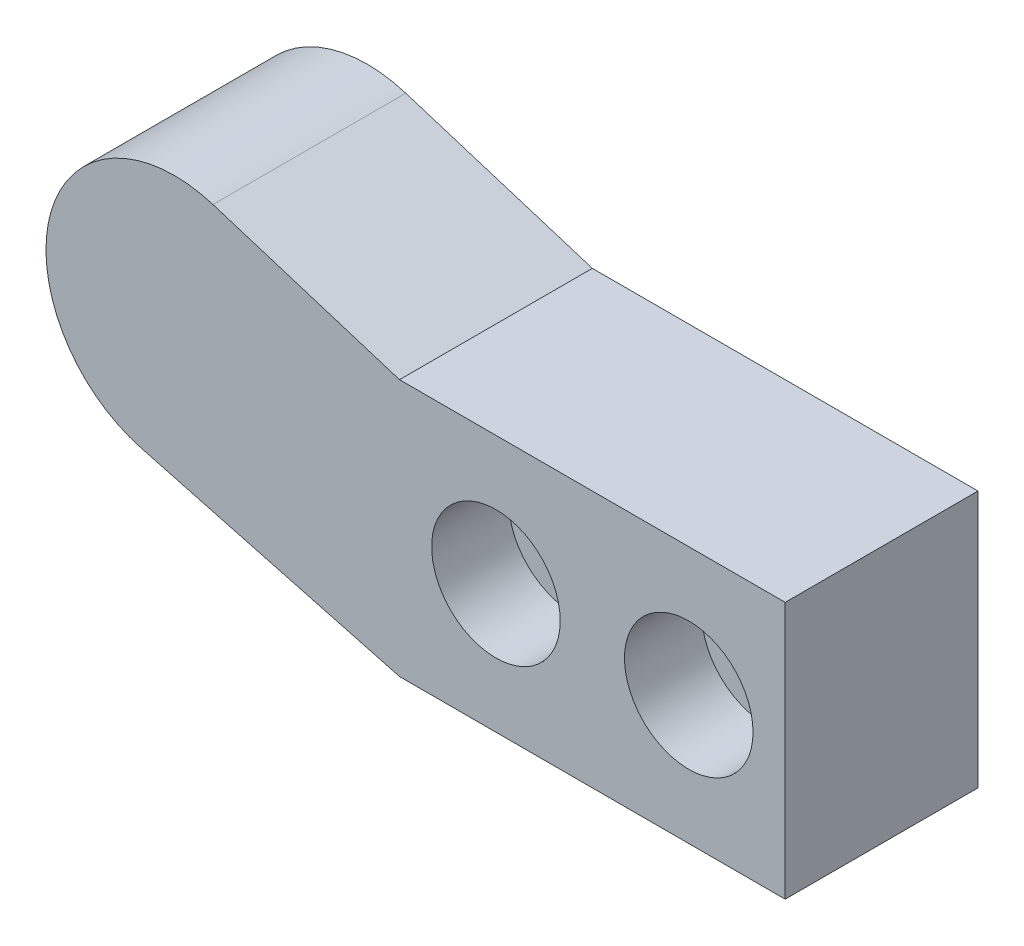
from build123d import *

# Parameters (mm, degrees)
SKETCH_1_R          = 3
EXTRUDE_1_DEPTH     = 15
SKETCH_2_R          = 5
CUT_EXTRUDE_1_DEPTH = 6
SKETCH_3_R          = 5
CUT_EXTRUDE_2_DEPTH = 3
SKETCH_4_R          = 2.5
CUT_EXTRUDE_3_DEPTH = 10


with BuildPart() as part:
    # 草图1 → 凸台-拉伸1 (new body)
    with BuildSketch(Plane.XY):
        with BuildLine():
            Line((0, 0), (30, 0))
            Line((30, 0), (30, -20))
            Line((30, -20), (0, -20))
            Line((0, -20), (-20.06938155, -14.664278475))
            ThreePointArc((-20.06938155, -14.664278475), (-27.106051537, -2.220832162), (-14.512363219, 4.543271266))
            Line((-14.512363219, 4.543271266), (0, 0))
        make_face()
        with Locations((7.5, -10)):
            Circle(SKETCH_1_R, mode=Mode.SUBTRACT)
        with Locations((22.5, -10)):
            Circle(SKETCH_1_R, mode=Mode.SUBTRACT)
    extrude(amount=EXTRUDE_1_DEPTH)

    # 草图2 → 切除-拉伸1 (cut)
    with BuildSketch(Plane.XY.offset(15)):
        with Locations((7.5, -10)):
            Circle(SKETCH_2_R)
        with Locations((22.5, -10)):
            Circle(SKETCH_2_R)
    extrude(amount=-CUT_EXTRUDE_1_DEPTH, mode=Mode.SUBTRACT)

    # 草图3 → 切除-拉伸2 (cut)
    with BuildSketch(Plane(origin=(0, 0, 0), x_dir=(-1, 0, 0), z_dir=(0, 0, -1))):
        with Locations((17.5, -5)):
            Circle(SKETCH_3_R)
    extrude(amount=-CUT_EXTRUDE_2_DEPTH, mode=Mode.SUBTRACT)

    # 草图4 → 切除-拉伸3 (cut)
    with BuildSketch(Plane(origin=(0, 0, 3), x_dir=(-1, 0, 0), z_dir=(0, 0, -1))):
        with Locations((17.5, -5)):
            Circle(SKETCH_4_R)
    extrude(amount=-CUT_EXTRUDE_3_DEPTH, mode=Mode.SUBTRACT)


solid = part.part
